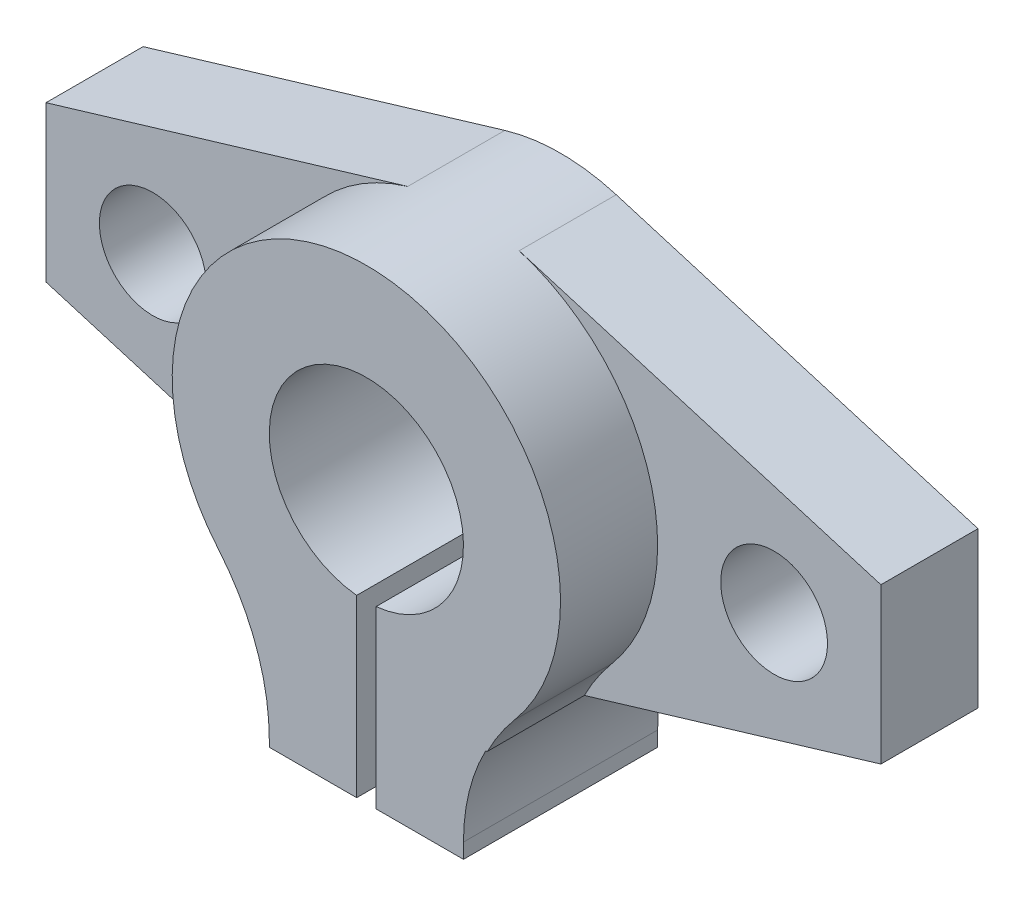
from build123d import *

# Parameters (mm, degrees)
SKETCH_1_R               = 2.75
EXTRUDE_4_DEPTH          = 5
EXTRUDE_5_DEPTH          = 5
EXTRUDE_START            = -10
SKETCH_6_R               = 5.188573112
EXTRUDE_6_DEPTH          = 10
CUT_EXTRUDE_1_DEPTH      = 28.536339626
CUT_EXTRUDE_1_DEPTH_BACK = 28.536339626


with BuildPart() as part:
    # Эскиз1 → Бобышка-Вытянуть4 (new body)
    with BuildSketch(Plane.XY):
        with BuildLine():
            Line((-21.5, 4), (-21.5, -4))
            Line((-21.5, -4), (-6.226230763, -8.574183073))
            ThreePointArc((-6.226230763, -8.574183073), (-5.310888369, -11.044106025), (-5, -13.659774106))
            Line((-5, -13.659774106), (-5, -14))
            Line((-5, -14), (-0.5, -14))
            Line((-0.5, -14), (-0.5, -5.164425519))
            ThreePointArc((-0.5, -5.164425519), (0, 5.188573112), (0.5, -5.164425519))
            Line((0.5, -5.164425519), (0.5, -14))
            Line((0.5, -14), (5, -14))
            Line((5, -14), (5, -13.228756555))
            ThreePointArc((5, -13.228756555), (5.287888706, -10.846552908), (6.134978844, -8.601511166))
            Line((6.134978844, -8.601511166), (21.5, -4))
            Line((21.5, -4), (21.5, 4))
            Line((21.5, 4), (2.868905356, 9.579633712))
            ThreePointArc((2.868905356, 9.579633712), (0, 10), (-2.868905356, 9.579633712))
            Line((-2.868905356, 9.579633712), (-21.5, 4))
        make_face()
        with Locations((-16, 0)):
            Circle(SKETCH_1_R, mode=Mode.SUBTRACT)
        with Locations((16, 0)):
            Circle(SKETCH_1_R, mode=Mode.SUBTRACT)
    extrude(amount=EXTRUDE_4_DEPTH)

    # Эскиз5 → Бобышка-Вытянуть5 (add)
    with BuildSketch(Plane.XY.offset(5)):
        with BuildLine():
            Line((-5, -14), (-0.5, -14))
            Line((-0.5, -14), (-0.5, -5.164425519))
            ThreePointArc((-0.5, -5.164425519), (-3.48762128, 3.841586749), (5.188573112, 0))
            ThreePointArc((5.188573112, 0), (3.841586749, -3.48762128), (0.5, -5.164425519))
            Line((0.5, -5.164425519), (0.5, -14))
            Line((0.5, -14), (5, -14))
            Line((5, -14), (5, -13.659774106))
            Line((5, -13.659774106), (5, -13.228756555))
            ThreePointArc((5, -13.228756555), (5.287888706, -10.846552908), (6.134978844, -8.601511166))
            Line((6.134978844, -8.601511166), (6.226230763, -8.574183073))
            ThreePointArc((6.226230763, -8.574183073), (6.870989069, -7.474637071), (7.636932983, -6.455792331))
            ThreePointArc((7.636932983, -6.455792331), (9.585242923, 2.850108438), (2.868905356, 9.579633712))
            ThreePointArc((2.868905356, 9.579633712), (0, 10), (-2.868905356, 9.579633712))
            ThreePointArc((-2.868905356, 9.579633712), (-9.585242923, 2.850108438), (-7.636932983, -6.455792331))
            ThreePointArc((-7.636932983, -6.455792331), (-6.870989069, -7.474637071), (-6.226230763, -8.574183073))
            ThreePointArc((-6.226230763, -8.574183073), (-5.310888369, -11.044106025), (-5, -13.659774106))
            Line((-5, -13.659774106), (-5, -14))
        make_face()
    extrude(amount=EXTRUDE_5_DEPTH)

    # Эскиз6 → Бобышка-Вытянуть6 (add)
    with BuildSketch(Plane.XY.offset(10).offset(EXTRUDE_START)):
        Circle(SKETCH_6_R)
    extrude(amount=EXTRUDE_6_DEPTH)

    # Эскиз7 → Вырез-Вытянуть1 (cut, two sides: drawn at the far end of the back side and taken through both)
    with BuildSketch(Plane.XY.offset(10).offset(-CUT_EXTRUDE_1_DEPTH_BACK)):
        with BuildLine():
            Line((-0.5, -4.974937186), (-0.5, -5.164425519))
            ThreePointArc((-0.5, -5.164425519), (0, -5.188573112), (0.5, -5.164425519))
            Line((0.5, -5.164425519), (0.5, -4.974937186))
            ThreePointArc((0.5, -4.974937186), (0, 5), (-0.5, -4.974937186))
        make_face()
    extrude(amount=CUT_EXTRUDE_1_DEPTH + CUT_EXTRUDE_1_DEPTH_BACK, mode=Mode.SUBTRACT)


solid = part.part
